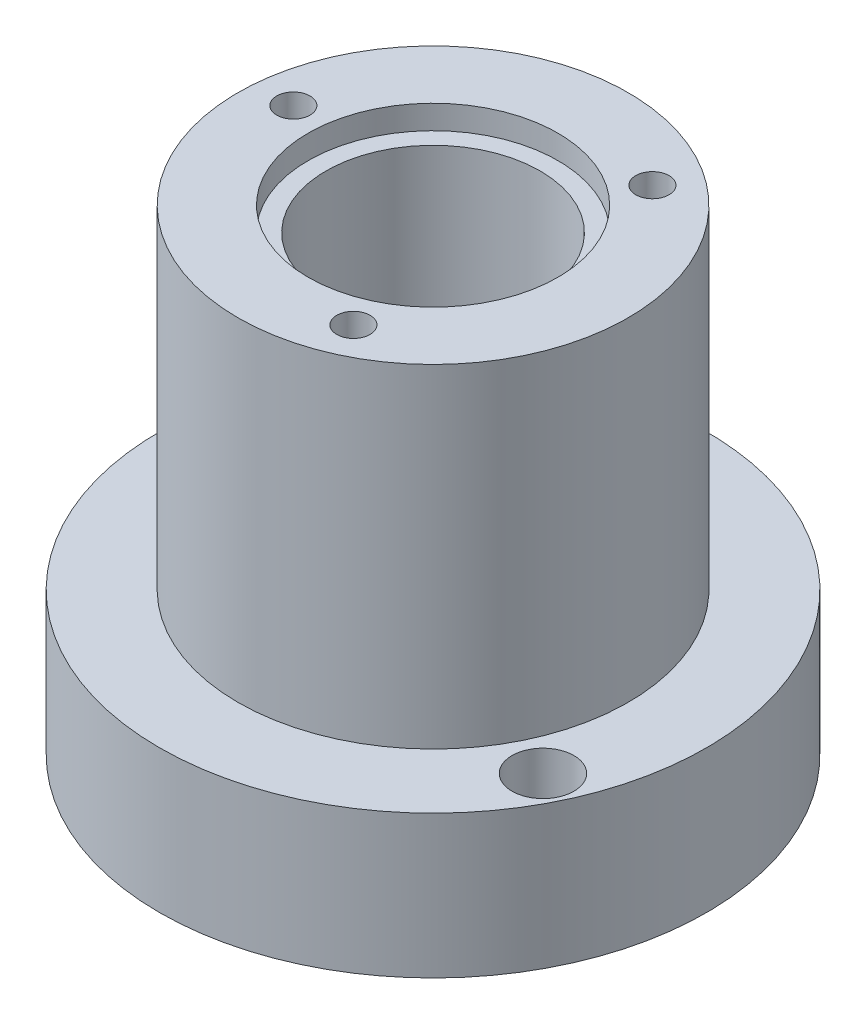
from build123d import *

# Parameters (mm, degrees)
SKETCH1_R                     = 14.605
BOSS_EXTRUDE2_DEPTH           = 25.4
SKETCH10_R                    = 5.715
CUT_EXTRUDE5_DEPTH            = 48.424233935
SKETCH11_R                    = 6.6675
CUT_EXTRUDE6_DEPTH            = 1.27
SKETCH12_OUTSIDE_W            = 40.908
SKETCH12_OUTSIDE_H            = 40.908
SKETCH12_OUTSIDE_R            = 10.414
CUT_EXTRUDE7_DEPTH            = 17.78
CIRPATTERN1_COUNT             = 3
CIRPATTERN2_COUNT             = 2
SKETCH26_R                    = 1.651
CUT_EXTRUDE8_DEPTH            = 8.89
CIRPATTERN3_COUNT             = 2
SKETCH27_R                    = 0.79375
CUT_EXTRUDE9_DEPTH            = 24.13
TAP_DRILL_FOR_0_80_TAP3_D     = 1.19126
TAP_DRILL_FOR_0_80_TAP3_DEPTH = 6.35
TAP_DRILL_FOR_0_80_TAP3_TIP   = 0.499792913


with BuildPart() as part:
    # Sketch1 → Boss-Extrude2 (new body)
    with BuildSketch(Plane(origin=(0, 0, 0), x_dir=(1, 0, 0), z_dir=(0, 1, 0))):
        with Locations(Location((13.028153923, -14.383045271, 0), (0, 0, 270))):
            Circle(SKETCH1_R)
    extrude(amount=BOSS_EXTRUDE2_DEPTH)

    # Sketch10 → Cut-Extrude5 (cut, through all)
    with BuildSketch(Plane(origin=(0, 25.4, 0), x_dir=(1, 0, 0), z_dir=(0, 1, 0))):
        with Locations(Location((13.028153923, -14.383045271, 0), (0, 0, 270))):
            Circle(SKETCH10_R)
    extrude(amount=-CUT_EXTRUDE5_DEPTH, mode=Mode.SUBTRACT)

    # Sketch11 → Cut-Extrude6 (cut)
    with BuildSketch(Plane(origin=(0, 25.4, 0), x_dir=(1, 0, 0), z_dir=(0, 1, 0))):
        with Locations(Location((13.028153923, -14.383045271, 0), (0, 0, 270))):
            Circle(SKETCH11_R)
    extrude(amount=-CUT_EXTRUDE6_DEPTH, mode=Mode.SUBTRACT)

    # Sketch12 outside → Cut-Extrude7 (cut)
    with BuildSketch(Plane(origin=(0, 25.4, 0), x_dir=(1, 0, 0), z_dir=(0, 1, 0))):
        with Locations((13.028, -14.383)):
            Rectangle(SKETCH12_OUTSIDE_W, SKETCH12_OUTSIDE_H)
        with Locations(Location((13.028153923, -14.383045271, 0), (0, 0, 270))):
            Circle(SKETCH12_OUTSIDE_R, mode=Mode.SUBTRACT)
    extrude(amount=-CUT_EXTRUDE7_DEPTH, mode=Mode.SUBTRACT)

    # Sketch17 → #50 (0.07) Diameter Hole1 (revolve, cut)
    with BuildSketch(Plane(origin=(4.692367215, 25.4, 13.504077717), x_dir=(0, 0, 1), z_dir=(1, 0, 0))):
        Polygon((0, 0), (0, 3.07416509), (0.889, 2.54), (0.889, 0), align=None)
    f_50_0_07_diameter_hole1 = revolve(axis=Axis((4.692367215, 31.75, 13.504077717), (0, -1, 0)), mode=Mode.SUBTRACT)

    # CirPattern1: #50 (0.07) Diameter Hole1 ×3 about axis
    cirpattern1_axis = Axis((13.028153923, 0, 14.383045271), (0, 1, 0))
    for i in range(1, CIRPATTERN1_COUNT):
        add(f_50_0_07_diameter_hole1.rotate(cirpattern1_axis, i * 360 / CIRPATTERN1_COUNT), mode=Mode.SUBTRACT)

    # Sketch24 → 1/16 (0.0625) Diameter Hole2 (revolve, cut)
    with BuildSketch(Plane(origin=(8.163266455, 0, 24.388191195), x_dir=(0, 0, -1), z_dir=(1, 0, 0))):
        Polygon((0, 0), (0, 4.477433116), (0.79375, 4.0005), (0.79375, 0), align=None)
    f_1_16_0_0625_diameter_hole2 = revolve(axis=Axis((8.163266455, -6.35, 24.388191195), (0, 1, 0)), mode=Mode.SUBTRACT)

    # CirPattern2: 1/16 (0.0625) Diameter Hole2 ×2 about axis
    cirpattern2_axis = Axis((13.028153923, 0, 14.383045271), (0, 1, 0))
    for i in range(1, CIRPATTERN2_COUNT):
        add(f_1_16_0_0625_diameter_hole2.rotate(cirpattern2_axis, i * 360 / CIRPATTERN2_COUNT), mode=Mode.SUBTRACT)

    # Sketch26 → Cut-Extrude8 (cut)
    with BuildSketch(Plane(origin=(0, 0, 0), x_dir=(-1, 0, 0), z_dir=(0, -1, 0))):
        with Locations(Location((-1.606754466, -8.829520764, 0), (0, 0, 90))):
            Circle(SKETCH26_R)
    cut_extrude8 = extrude(amount=-CUT_EXTRUDE8_DEPTH, mode=Mode.SUBTRACT)

    # CirPattern3: Cut-Extrude8 ×2 about axis
    cirpattern3_axis = Axis((13.028153923, 0, 14.383045271), (0, 1, 0))
    for i in range(1, CIRPATTERN3_COUNT):
        add(cut_extrude8.rotate(cirpattern3_axis, i * 360 / CIRPATTERN3_COUNT), mode=Mode.SUBTRACT)

    # Sketch27 → Cut-Extrude9 (cut)
    with BuildSketch(Plane(origin=(0, 0, 0), x_dir=(-1, 0, 0), z_dir=(0, -1, 0))):
        with Locations(Location((-5.827402564, -17.142659866, 0), (0, 0, 90))):
            Circle(SKETCH27_R)
    extrude(amount=-CUT_EXTRUDE9_DEPTH, mode=Mode.SUBTRACT)

    # Tap Drill for #0-80 Tap3
    with Locations(Plane(origin=(0, 0, 0), x_dir=(-1, 0, 0), z_dir=(0, -1, 0))):
        with Locations((-5.827402564, -15.237659866), (-5.827402564, -19.047659866)):
            Hole(TAP_DRILL_FOR_0_80_TAP3_D / 2, depth=TAP_DRILL_FOR_0_80_TAP3_DEPTH)
            with Locations((0, 0, -(TAP_DRILL_FOR_0_80_TAP3_DEPTH + TAP_DRILL_FOR_0_80_TAP3_TIP / 2))):  # 100° drill point
                Cone(0, TAP_DRILL_FOR_0_80_TAP3_D / 2, TAP_DRILL_FOR_0_80_TAP3_TIP, mode=Mode.SUBTRACT)


solid = part.part
